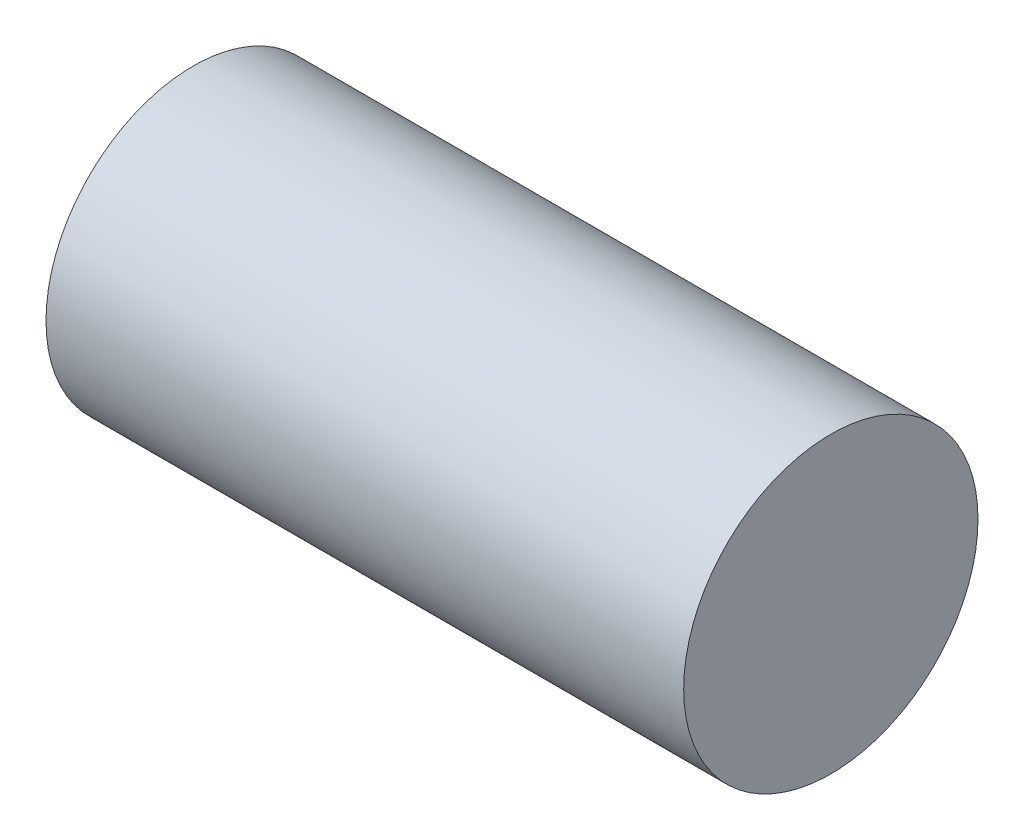
from build123d import *

# Parameters (mm, degrees)
SKETCH1_R           = 6
BOSS_EXTRUDE1_DEPTH = 26


with BuildPart() as part:
    # Sketch1 → Boss-Extrude1 (new body)
    with BuildSketch(Plane(origin=(0, 0, 0), x_dir=(0, 0, -1), z_dir=(1, 0, 0))):
        Circle(SKETCH1_R)
    extrude(amount=BOSS_EXTRUDE1_DEPTH)


solid = part.part
